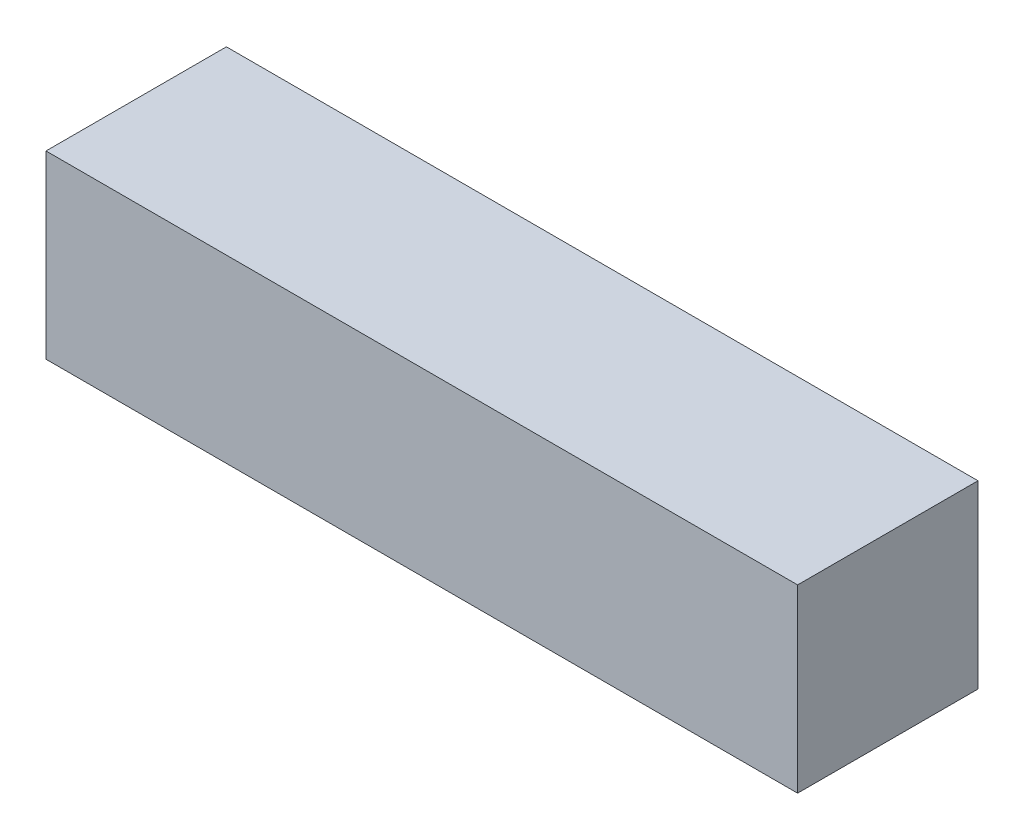
from build123d import *

# Parameters (mm, degrees)
SKETCH1_W           = 125
SKETCH1_H           = 30
BOSS_EXTRUDE1_DEPTH = 30


with BuildPart() as part:
    # Sketch1 → Boss-Extrude1 (new body)
    with BuildSketch(Plane(origin=(0, 0, 0), x_dir=(1, 0, 0), z_dir=(0, 1, 0))):
        with Locations((62.5, 15)):
            Rectangle(SKETCH1_W, SKETCH1_H)
    extrude(amount=BOSS_EXTRUDE1_DEPTH)


solid = part.part
